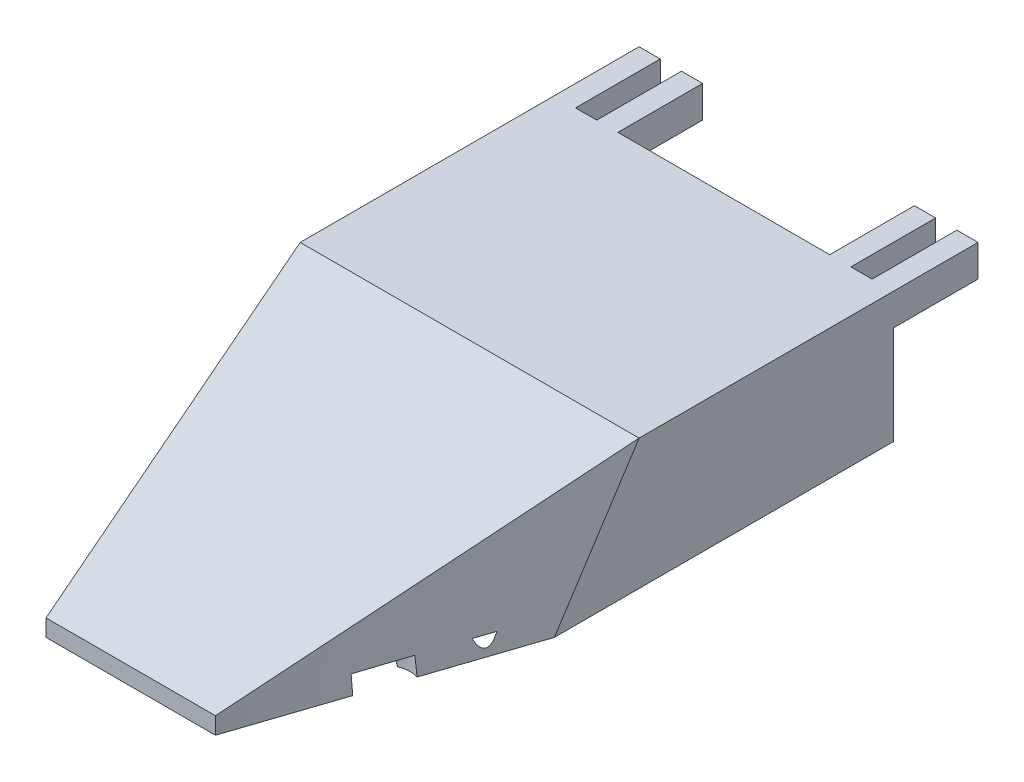
from build123d import *

# Parameters (mm, degrees)
BOSS_EXTRUDE2_DEPTH = 32
SHELL1_T            = -1.6
SKETCH6_W           = 2
SKETCH6_H           = 8
BOSS_EXTRUDE3_DEPTH = 3
SKETCH8_R           = 2.4
CUT_EXTRUDE2_DEPTH  = 1.6


with BuildPart() as part:
    # Sketch4 → Boss-Extrude2 (new body)
    with BuildSketch(Plane(origin=(0, 0, 0), x_dir=(0, 0, -1), z_dir=(1, 0, 0))):
        Polygon((0, 0), (0, 12.3), (-24, 12.3), (-32, 0), align=None)
    extrude(amount=BOSS_EXTRUDE2_DEPTH)

    # Sketch5 → section 0 of loft1
    with BuildSketch(Plane.XY.offset(56), mode=Mode.PRIVATE) as loft1_s0:
        with BuildLine():
            Line((24, 0), (8, 0))
            Line((8, 0), (8, 1.6))
            Line((8, 1.6), (24, 1.6))
            Line((24, 1.6), (24, 0))
        make_face()
    # loft up to a face of the part (loft1)
    loft([loft1_s0.sketch, part.faces().sort_by_distance((16, 6.15, 28))[0]])

    # Shell1
    shell1_openings = [part.faces().sort_by_distance(p)[0] for p in [
        (16, 0, 25.6),
    ]]
    offset(amount=SHELL1_T, openings=shell1_openings)

    # Sketch6 → Boss-Extrude3 (add)
    with BuildSketch(Plane(origin=(0, 12.3, 0), x_dir=(1, 0, 0), z_dir=(0, 1, 0))):
        with Locations((1, 4)):
            Rectangle(SKETCH6_W, SKETCH6_H)
        with Locations((5, 4)):
            Rectangle(SKETCH6_W, SKETCH6_H)
        with Locations((31, 4)):
            Rectangle(SKETCH6_W, SKETCH6_H)
        with Locations((27, 4)):
            Rectangle(SKETCH6_W, SKETCH6_H)
    extrude(amount=-BOSS_EXTRUDE3_DEPTH)

    # Sketch8 → Cut-Extrude2 (cut)
    with BuildSketch(Plane(origin=(0, 0, 0), x_dir=(1, 0, 0), z_dir=(0, 1, 0))):
        with Locations((28, -44)):
            Circle(SKETCH8_R)
        with Locations((28, -36)):
            Circle(SKETCH8_R)
        with Locations((4, -44)):
            Circle(SKETCH8_R)
        with Locations((4, -36)):
            Circle(SKETCH8_R)
    extrude(amount=CUT_EXTRUDE2_DEPTH, mode=Mode.SUBTRACT)


solid = part.part
